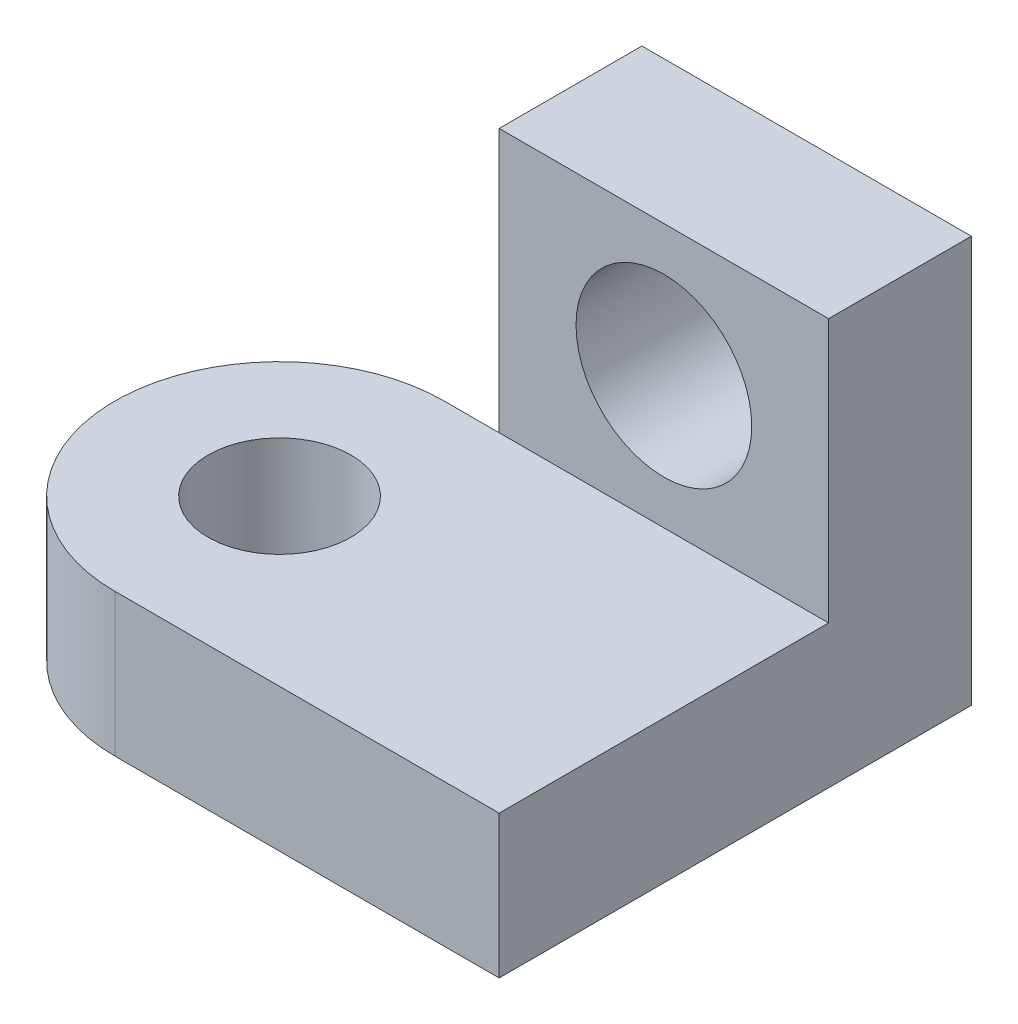
from build123d import *

# Parameters (mm, degrees)
SKETCH1_W           = 30
SKETCH1_H           = 24
SKETCH1_R           = 8
BOSS_EXTRUDE1_DEPTH = 13
BOSS_EXTRUDE2_DEPTH = 43
SKETCH2_W           = 20
SKETCH2_H           = 13
CUT_EXTRUDE1_DEPTH  = 43
CUT_EXTRUDE3_DEPTH  = 43
SKETCH4_R           = 6.5
CUT_EXTRUDE4_DEPTH  = 43


with BuildPart() as part:
    # Sketch1 → Boss-Extrude1 (new body)
    with BuildSketch(Plane.XY):
        with Locations((-15, 25)):
            Rectangle(SKETCH1_W, SKETCH1_H)
        with Locations((-15, 25)):
            Circle(SKETCH1_R, mode=Mode.SUBTRACT)
    extrude(amount=BOSS_EXTRUDE1_DEPTH)

    # Sketch1<3> → Boss-Extrude2 (add)
    with BuildSketch(Plane.XY):
        Polygon((0, 13), (-30, 13), (-50, 13), (-50, 0), (0, 0), align=None)
    extrude(amount=BOSS_EXTRUDE2_DEPTH)

    # Sketch2 → Cut-Extrude1 (cut)
    with BuildSketch(Plane(origin=(0, 13, 0), x_dir=(1, 0, 0), z_dir=(0, 1, 0))):
        with Locations((-40, -6.5)):
            Rectangle(SKETCH2_W, SKETCH2_H)
    extrude(amount=-CUT_EXTRUDE1_DEPTH, mode=Mode.SUBTRACT)

    # Sketch3 → Cut-Extrude3 (cut)
    with BuildSketch(Plane(origin=(0, 13, 0), x_dir=(1, 0, 0), z_dir=(0, 1, 0))):
        with BuildLine():
            ThreePointArc((-50, -28), (-45.606601718, -17.393398282), (-35, -13))
            Line((-35, -13), (-50, -13))
            Line((-50, -13), (-50, -28))
        make_face()
        with BuildLine():
            ThreePointArc((-35, -43), (-45.606601718, -38.606601718), (-50, -28))
            Line((-50, -28), (-50, -43))
            Line((-50, -43), (-35, -43))
        make_face()
    extrude(amount=-CUT_EXTRUDE3_DEPTH, mode=Mode.SUBTRACT)

    # Sketch4 → Cut-Extrude4 (cut)
    with BuildSketch(Plane(origin=(0, 13, 0), x_dir=(1, 0, 0), z_dir=(0, 1, 0))):
        with Locations((-35, -28)):
            Circle(SKETCH4_R)
    extrude(amount=-CUT_EXTRUDE4_DEPTH, mode=Mode.SUBTRACT)


solid = part.part
